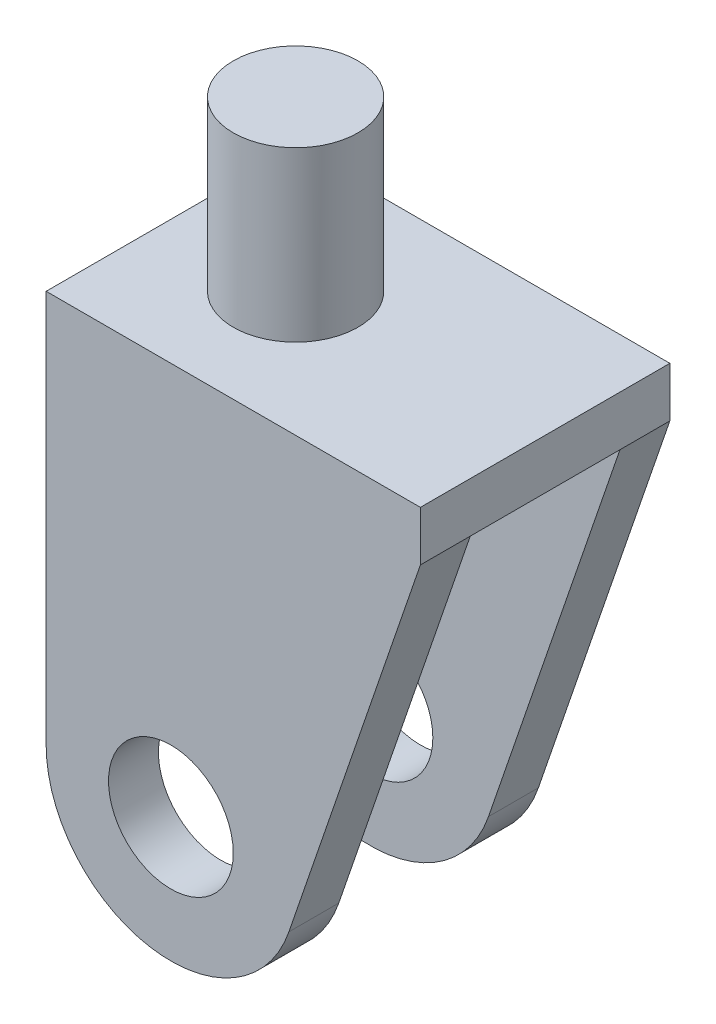
from build123d import *

# Parameters (mm, degrees)
SKETCH_1_R          = 10
EXTRUDE_1_DEPTH     = 20
CUT_EXTRUDE_1_DEPTH = 12
SKETCH_3_R          = 10
EXTRUDE_2_DEPTH     = 27


with BuildPart() as part:
    # 草图1 → 凸台-拉伸1 (new, symmetric)
    with BuildSketch(Plane.XY):
        with BuildLine():
            Line((40, 55), (18.91891904, -6.48648649))
            ThreePointArc((18.91891904, -6.48648649), (-3.287979748, -19.727878593), (-20.000000115, 0))
            Line((-20.000000115, 0), (-20.000000115, 55))
            Line((-20.000000115, 55), (-20.000000115, 63))
            Line((-20.000000115, 63), (40, 63))
            Line((40, 63), (40, 55))
        make_face()
        Circle(SKETCH_1_R, mode=Mode.SUBTRACT)
    extrude(amount=EXTRUDE_1_DEPTH, both=True)

    # 草图2 → 切除-拉伸1 (cut, symmetric)
    with BuildSketch(Plane.XY):
        with BuildLine():
            Line((18.91891904, -6.48648649), (40, 55))
            Line((40, 55), (-20.000000115, 55))
            Line((-20.000000115, 55), (-20.000000115, 0))
            ThreePointArc((-20.000000115, 0), (-3.287979748, -19.727878593), (18.91891904, -6.48648649))
        make_face()
    extrude(amount=CUT_EXTRUDE_1_DEPTH, both=True, mode=Mode.SUBTRACT)

    # 草图3 → 凸台-拉伸2 (add)
    with BuildSketch(Plane(origin=(0, 63, 0), x_dir=(1, 0, 0), z_dir=(0, 1, 0))):
        with Locations(Location((0, 0, 0), (0, 0, 90))):
            Circle(SKETCH_3_R)
    extrude(amount=EXTRUDE_2_DEPTH)


solid = part.part
